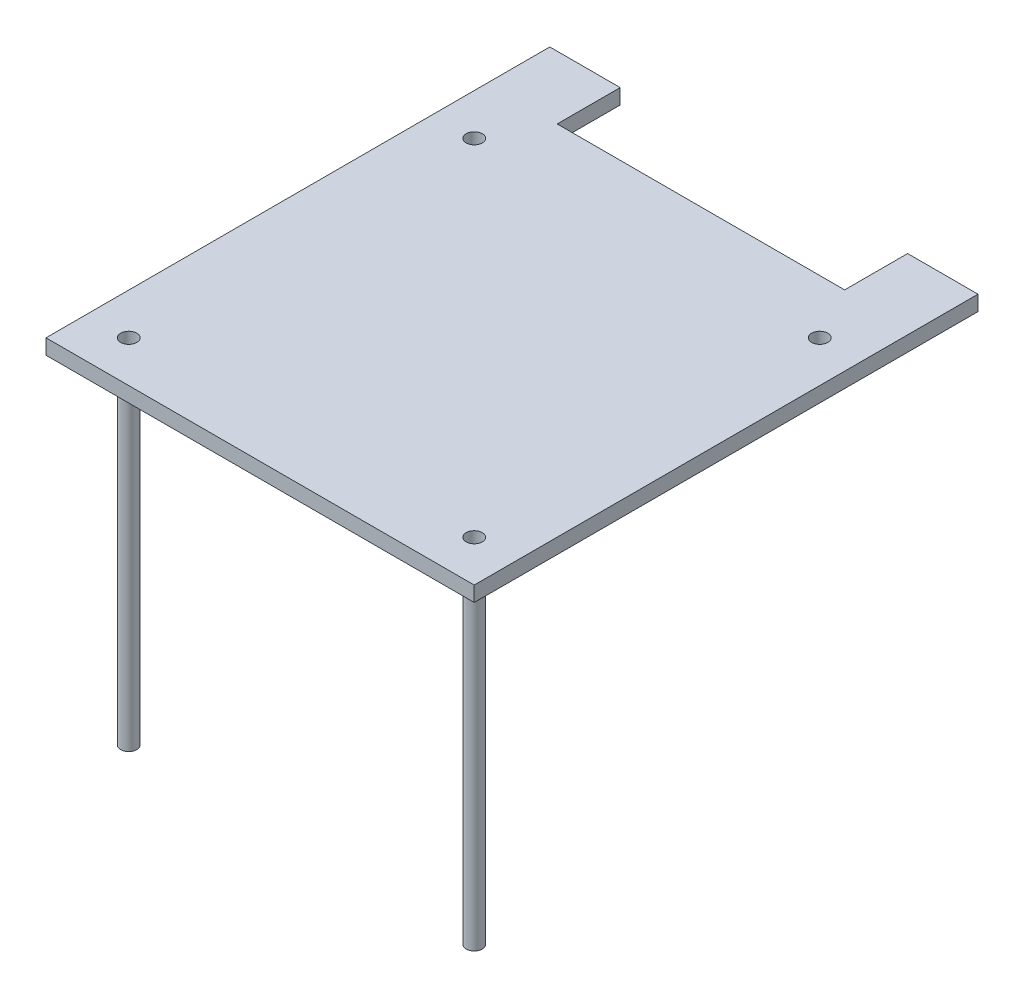
from build123d import *

# Parameters (mm, degrees)
SKETCH1_W             = 85
SKETCH1_H             = 100
BOSS_EXTRUDE1_DEPTH   = 3
SKETCH2_R             = 1.6
CUT_EXTRUDE1_DEPTH    = 66.690562488
SKETCH3_R             = 1.6
BOSS_EXTRUDE2_DEPTH   = 67
BOSS_EXTRUDE2_2_DEPTH = 67
SKETCH4_W             = 57.05674143
SKETCH4_H             = 25
CUT_EXTRUDE2_DEPTH    = 96.949205312


with BuildPart() as part:
    # Sketch1 → Boss-Extrude1 (new body)
    with BuildSketch(Plane(origin=(0, 0, 0), x_dir=(1, 0, 0), z_dir=(0, 1, 0))):
        Rectangle(SKETCH1_W, SKETCH1_H)
    extrude(amount=BOSS_EXTRUDE1_DEPTH)

    # Sketch2 → Cut-Extrude1 (cut, through all)
    with BuildSketch(Plane(origin=(0, 3, 0), x_dir=(1, 0, 0), z_dir=(0, 1, 0))):
        with Locations(Location((-34.29, 26.79, 0), (0, 0, 270))):
            Circle(SKETCH2_R)
        with Locations(Location((-34.29, -41.79, 0), (0, 0, 270))):
            Circle(SKETCH2_R)
        with Locations(Location((34.29, -41.79, 0), (0, 0, 90))):
            Circle(SKETCH2_R)
        with Locations(Location((34.29, 26.79, 0), (0, 0, 90))):
            Circle(SKETCH2_R)
    extrude(amount=-CUT_EXTRUDE1_DEPTH, mode=Mode.SUBTRACT)

    # Sketch4 → Cut-Extrude2 (cut, through all)
    with BuildSketch(Plane(origin=(0, 3, 0), x_dir=(1, 0, 0), z_dir=(0, 1, 0))):
        with Locations((0, 50)):
            Rectangle(SKETCH4_W, SKETCH4_H)
    extrude(amount=-CUT_EXTRUDE2_DEPTH, mode=Mode.SUBTRACT)


with BuildPart() as body_2:
    # Sketch3 → Boss-Extrude2 (new body)
    with BuildSketch(Plane.XZ):
        with Locations(Location((-34.29, 41.79, 0), (0, 0, 270))):
            Circle(SKETCH3_R)
    extrude(amount=BOSS_EXTRUDE2_DEPTH)


with BuildPart() as body_3:
    # Sketch3 → Boss-Extrude2 2 (new body)
    with BuildSketch(Plane.XZ):
        with Locations(Location((34.29, 41.79, 0), (0, 0, 270))):
            Circle(SKETCH3_R)
    extrude(amount=BOSS_EXTRUDE2_2_DEPTH)


solid = Compound([part.part, body_2.part, body_3.part])
